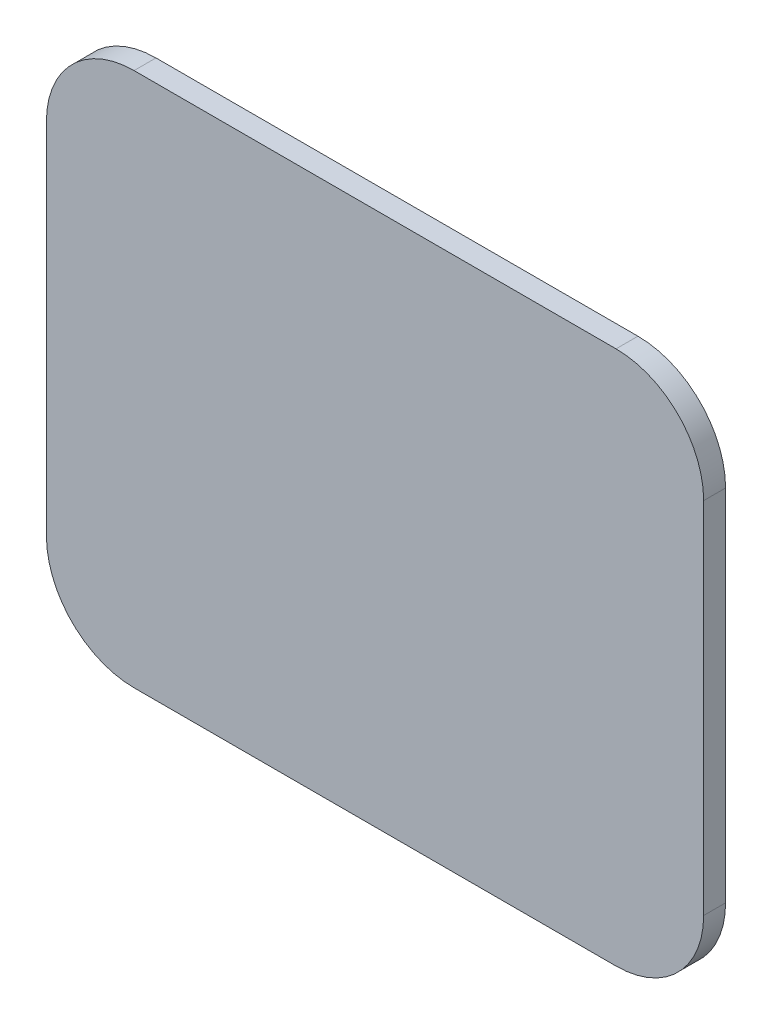
from build123d import *

# Parameters (mm, degrees)
EXTRUDE_1_DEPTH = 5


with BuildPart() as part:
    # 草图1 → 凸台-拉伸1 (new body)
    with BuildSketch(Plane.XY):
        with BuildLine():
            Line((-55, -61), (55, -61))
            ThreePointArc((55, -61), (69.142135624, -55.142135624), (75, -41))
            Line((75, -41), (75, 41))
            ThreePointArc((75, 41), (69.142135624, 55.142135624), (55, 61))
            Line((55, 61), (-55, 61))
            ThreePointArc((-55, 61), (-69.142135624, 55.142135624), (-75, 41))
            Line((-75, 41), (-75, -41))
            ThreePointArc((-75, -41), (-69.142135624, -55.142135624), (-55, -61))
        make_face()
    extrude(amount=EXTRUDE_1_DEPTH)


solid = part.part
